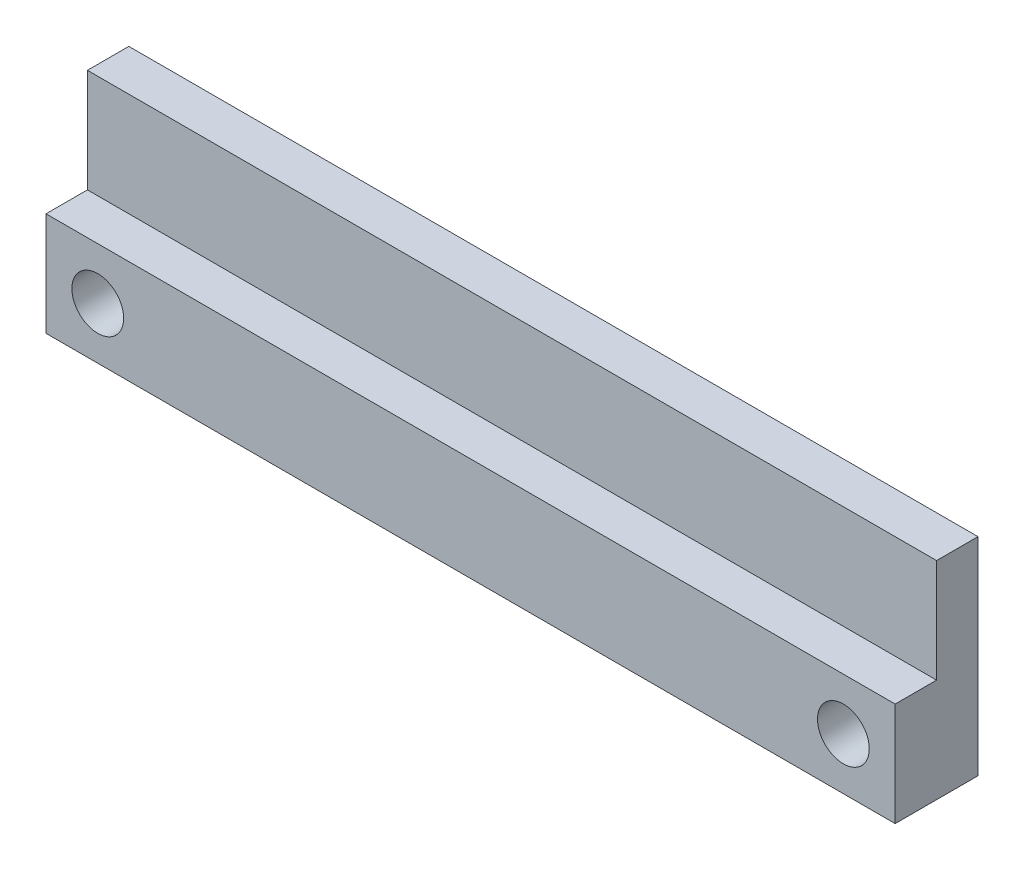
from build123d import *

# Parameters (mm, degrees)
SKETCH_1_W          = 41
SKETCH_1_H          = 10
EXTRUDE_1_DEPTH     = 2
SKETCH_2_W          = 41
SKETCH_2_H          = 5
EXTRUDE_2_DEPTH     = 2
SKETCH_3_R          = 1.25
CUT_EXTRUDE_1_DEPTH = 28.728178021


with BuildPart() as part:
    # 草圖1 → 填料-伸長1 (new body)
    with BuildSketch(Plane.XY):
        with Locations((4.676919413, 5.90754717)):
            Rectangle(SKETCH_1_W, SKETCH_1_H)
    extrude(amount=EXTRUDE_1_DEPTH)

    # 草圖2 → 填料-伸長2 (add)
    with BuildSketch(Plane.XY.offset(2)):
        with Locations((4.676919413, 3.40754717)):
            Rectangle(SKETCH_2_W, SKETCH_2_H)
    extrude(amount=EXTRUDE_2_DEPTH)

    # 草圖3 → 除料-伸長1 (cut, through all)
    with BuildSketch(Plane.XY.offset(4)):
        with Locations((-13.323080587, 3.40754717)):
            Circle(SKETCH_3_R)
        with Locations((22.676919413, 3.40754717)):
            Circle(SKETCH_3_R)
    extrude(amount=-CUT_EXTRUDE_1_DEPTH, mode=Mode.SUBTRACT)


solid = part.part
